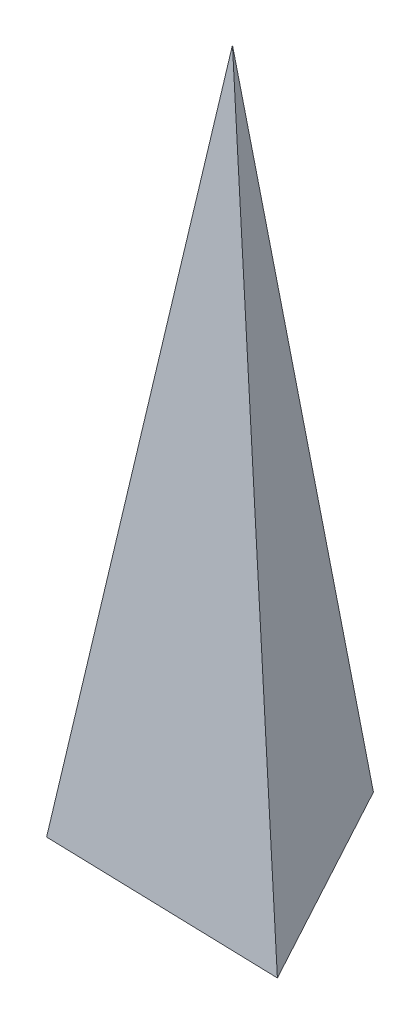
from build123d import *

# Parameters (mm, degrees)
EXTRUDE_1_DEPTH = 75
EXTRUDE_1_TAPER = 5.49


with BuildPart() as part:
    # 草图1 → 凸台-拉伸1 (new body)
    with BuildSketch(Plane(origin=(0, 0, 0), x_dir=(1, 0, 0), z_dir=(0, 1, 0))):
        Polygon((12.29262896, -7.564694745), (0.404903341, 14.428076331), (-12.697532301, -6.863381586), align=None)
    extrude(amount=EXTRUDE_1_DEPTH, taper=EXTRUDE_1_TAPER)


solid = part.part
